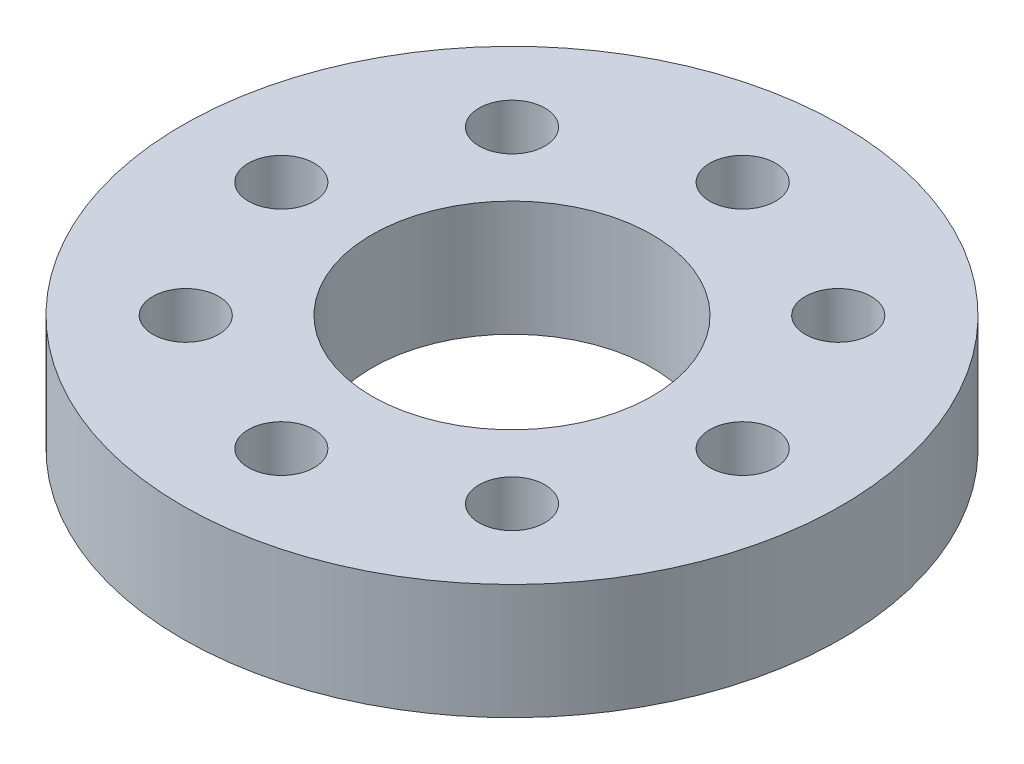
from build123d import *

# Parameters (mm, degrees)
SKETCH2_R           = 10
SKETCH2_R_2         = 4.25
SKETCH2_R_3         = 1
BOSS_EXTRUDE1_DEPTH = 3.5


with BuildPart() as part:
    # Sketch2 → Boss-Extrude1 (new body)
    with BuildSketch(Plane(origin=(0, 0, 0), x_dir=(1, 0, 0), z_dir=(0, 1, 0))):
        with Locations(Location((0, 0, 0), (0, 0, 270))):
            Circle(SKETCH2_R)
        with Locations(Location((0, 0, 0), (0, 0, 270))):
            Circle(SKETCH2_R_2, mode=Mode.SUBTRACT)
        with Locations(Location((0, 7, 0), (0, 0, 270))):
            Circle(SKETCH2_R_3, mode=Mode.SUBTRACT)
        with Locations(Location((4.949747468, 4.949747468, 0), (0, 0, 270))):
            Circle(SKETCH2_R_3, mode=Mode.SUBTRACT)
        with Locations(Location((7, 0, 0), (0, 0, 270))):
            Circle(SKETCH2_R_3, mode=Mode.SUBTRACT)
        with Locations(Location((4.949747468, -4.949747468, 0), (0, 0, 270))):
            Circle(SKETCH2_R_3, mode=Mode.SUBTRACT)
        with Locations(Location((0, -7, 0), (0, 0, 270))):
            Circle(SKETCH2_R_3, mode=Mode.SUBTRACT)
        with Locations(Location((-4.949747468, -4.949747468, 0), (0, 0, 270))):
            Circle(SKETCH2_R_3, mode=Mode.SUBTRACT)
        with Locations(Location((-7, 0, 0), (0, 0, 270))):
            Circle(SKETCH2_R_3, mode=Mode.SUBTRACT)
        with Locations(Location((-4.949747468, 4.949747468, 0), (0, 0, 270))):
            Circle(SKETCH2_R_3, mode=Mode.SUBTRACT)
    extrude(amount=BOSS_EXTRUDE1_DEPTH)


solid = part.part
